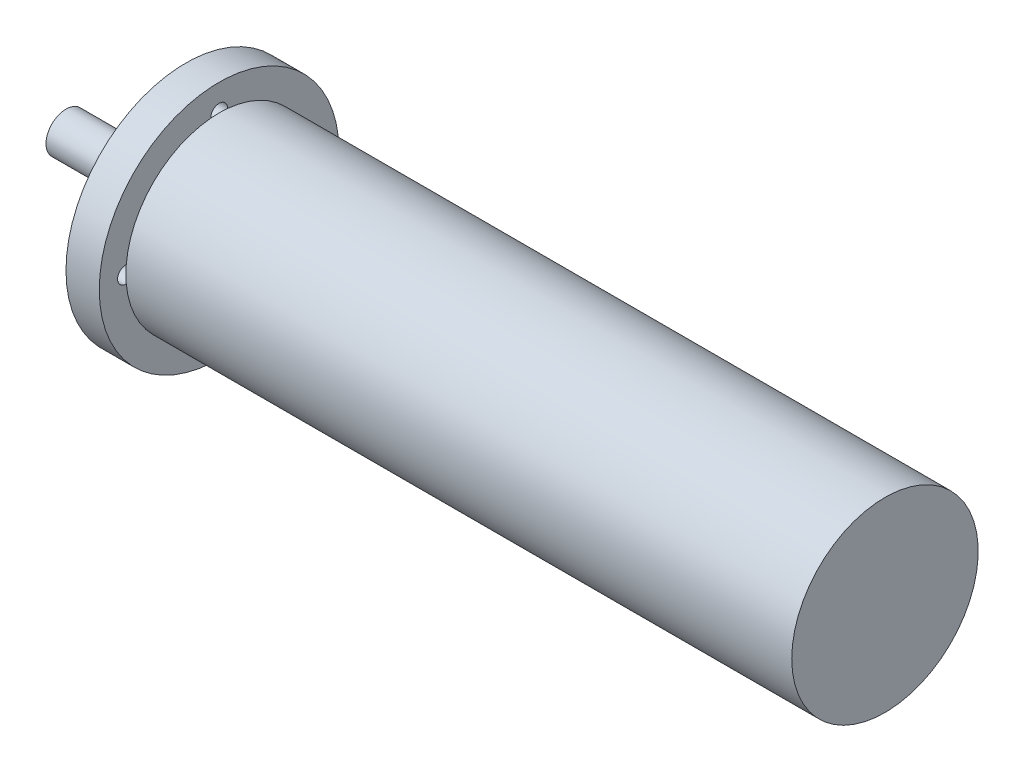
from build123d import *

# Parameters (mm, degrees)
ESQUISSE2_R             = 1.25
ENL_V_MAT_EXTRU_1_DEPTH = 5


with BuildPart() as part:
    # Esquisse1 → Révolution1 (revolve)
    with BuildSketch(Plane.XY, mode=Mode.PRIVATE) as r_volution1_sk:
        Polygon((0, 0), (123, 0), (123, 14), (23, 14), (23, 18), (18, 18), (18, 11), (16, 11), (16, 3), (0, 3), align=None)
    revolve(r_volution1_sk.sketch.rotate(Axis((-16, 0, 0), (1, 0, 0)), 90), axis=Axis((-16, 0, 0), (1, 0, 0)))

    # Esquisse2 → Enlèv. mat.-Extru.1 (cut)
    with BuildSketch(Plane.ZY.offset(-18)):
        with Locations((0, 14)):
            Circle(ESQUISSE2_R)
        with Locations((14, 0)):
            Circle(ESQUISSE2_R)
        with Locations((0, -14)):
            Circle(ESQUISSE2_R)
        with Locations((-14, 0)):
            Circle(ESQUISSE2_R)
    extrude(amount=-ENL_V_MAT_EXTRU_1_DEPTH, mode=Mode.SUBTRACT)


solid = part.part
